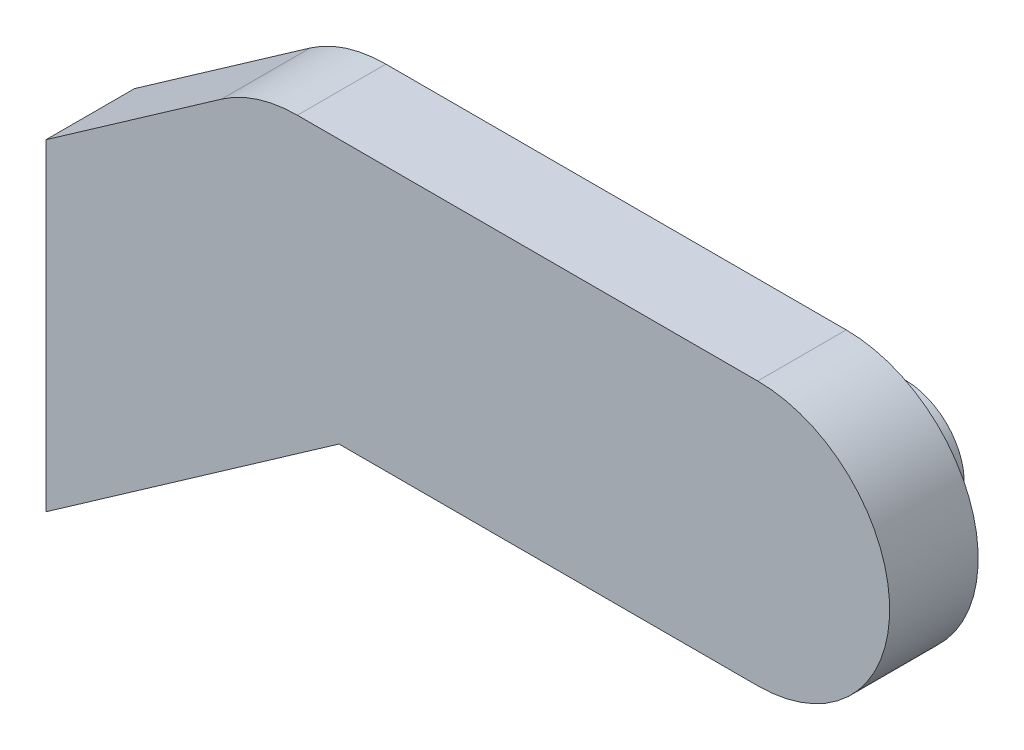
from build123d import *

# Parameters (mm, degrees)
SKETCH_1_W          = 300
SKETCH_1_H          = 44.73
EXTRUDE_1_DEPTH     = 15
CUT_EXTRUDE_4_REACH = 305.687
SKETCH_6_R          = 10
EXTRUDE_2_DEPTH     = 10
SKETCH_7_R          = 1
CUT_EXTRUDE_6_DEPTH = 5
EXTRUDE_START       = 15
EXTRUDE_5_DEPTH     = 15
CUT_EXTRUDE_7_DEPTH = 15


with BuildPart() as part:
    # 草图1 → 凸台-拉伸1 (new body)
    with BuildSketch(Plane.XY):
        with Locations((150, 22.365)):
            Rectangle(SKETCH_1_W, SKETCH_1_H)
    extrude(amount=EXTRUDE_1_DEPTH)

    # 草图4 → 切除-拉伸4 (cut, up to next)
    with BuildSketch(Plane.XY.offset(15), mode=Mode.PRIVATE) as cut_extrude_4_sk1:
        with BuildLine():
            Line((300, 44.73), (153.211623388, 44.73))
            ThreePointArc((153.211623388, 44.73), (175.576623388, 22.365), (153.211623388, 0))
            Line((153.211623388, 0), (300, 0))
            Line((300, 0), (300, 44.73))
        make_face()
    cut_extrude_4_tool1 = extrude(cut_extrude_4_sk1.sketch, amount=-CUT_EXTRUDE_4_REACH, mode=Mode.PRIVATE) & part.part
    add(cut_extrude_4_tool1.solids().sort_by_distance((235.292113, 22.365, 15))[0], mode=Mode.SUBTRACT)

    # 草图6 → 凸台-拉伸2 (add)
    with BuildSketch(Plane(origin=(0, 0, 0), x_dir=(-1, 0, 0), z_dir=(0, 0, -1))):
        with Locations((-153.211623388, 22.365)):
            Circle(SKETCH_6_R)
    extrude(amount=EXTRUDE_2_DEPTH)

    # 草图7 → 切除-拉伸6 (cut)
    with BuildSketch(Plane(origin=(0, 0, -10), x_dir=(-1, 0, 0), z_dir=(0, 0, -1))):
        with Locations((-153.211623388, 29.365)):
            Circle(SKETCH_7_R)
        with Locations((-146.211623388, 22.365)):
            Circle(SKETCH_7_R)
        with Locations((-153.211623388, 15.365)):
            Circle(SKETCH_7_R)
        with Locations((-160.211623388, 22.365)):
            Circle(SKETCH_7_R)
    extrude(amount=-CUT_EXTRUDE_6_DEPTH, mode=Mode.SUBTRACT)

    # 草图9 → 凸台-拉伸5 (add)
    # profile 1 of 8: a face of its own
    with BuildSketch(Plane.XY.offset(EXTRUDE_START)):
        with BuildLine():
            ThreePointArc((56.891287917, 9.536963001), (53.186397992, 26.248641494), (62.383586389, 40.685335471))
            Line((62.383586389, 40.685335471), (32.615717085, 19.841648987))
            Line((32.615717085, 19.841648987), (32.615717085, -7.46097469))
            Line((32.615717085, -7.46097469), (56.891287917, 9.536963001))
        make_face()
    # profile 2 of 8: a face of its own
    with BuildSketch(Plane.XY.offset(EXTRUDE_START)):
        with BuildLine():
            ThreePointArc((75.211623388, 0), (64.884615653, 2.527002716), (56.891287917, 9.536963001))
            Line((56.891287917, 9.536963001), (32.615717085, -7.46097469))
            Line((32.615717085, -7.46097469), (32.615717085, -34.763598368))
            Line((32.615717085, -34.763598368), (82.263280801, 0))
            Line((82.263280801, 0), (75.211623388, 0))
        make_face()
    # profile 3 of 8: a face of its own
    with BuildSketch(Plane.XY.offset(EXTRUDE_START)):
        with BuildLine():
            ThreePointArc((97.576623388, 22.365), (91.026066549, 38.179443161), (75.211623388, 44.73))
            ThreePointArc((75.211623388, 44.73), (68.486338182, 43.694879603), (62.383586389, 40.685335471))
            ThreePointArc((62.383586389, 40.685335471), (53.186397992, 26.248641494), (56.891287917, 9.536963001))
            Line((56.891287917, 9.536963001), (75.211623388, 22.365))
            Line((75.211623388, 22.365), (97.576623388, 22.365))
        make_face()
    # profile 4 of 8: a face of its own
    with BuildSketch(Plane.XY.offset(EXTRUDE_START)):
        with BuildLine():
            ThreePointArc((88.039660387, 4.044664529), (95.049620672, 12.037992265), (97.576623388, 22.365))
            Line((97.576623388, 22.365), (75.211623388, 22.365))
            Line((75.211623388, 22.365), (56.891287917, 9.536963001))
            ThreePointArc((56.891287917, 9.536963001), (64.884615653, 2.527002716), (75.211623388, 0))
            ThreePointArc((75.211623388, 0), (81.936908594, 1.035120397), (88.039660387, 4.044664529))
        make_face()
    # profile 5 of 8: a face of its own
    with BuildSketch(Plane.XY.offset(EXTRUDE_START)):
        with BuildLine():
            ThreePointArc((153.211623388, 0), (137.397180227, 6.550556839), (130.846623388, 22.365))
            Line((130.846623388, 22.365), (97.576623388, 22.365))
            ThreePointArc((97.576623388, 22.365), (95.049620672, 12.037992265), (88.039660387, 4.044664529))
            Line((88.039660387, 4.044664529), (82.263280801, 0))
            Line((82.263280801, 0), (153.211623388, 0))
        make_face()
    # profile 6 of 8: a face of its own
    with BuildSketch(Plane.XY.offset(EXTRUDE_START)):
        with BuildLine():
            ThreePointArc((130.846623388, 22.365), (137.397180227, 38.179443161), (153.211623388, 44.73))
            Line((153.211623388, 44.73), (75.211623388, 44.73))
            ThreePointArc((75.211623388, 44.73), (91.026066549, 38.179443161), (97.576623388, 22.365))
            Line((97.576623388, 22.365), (130.846623388, 22.365))
        make_face()
    # profile 7 of 8: a face of its own
    with BuildSketch(Plane.XY.offset(EXTRUDE_START)):
        with BuildLine():
            ThreePointArc((175.576623388, 22.365), (169.026066549, 38.179443161), (153.211623388, 44.73))
            ThreePointArc((153.211623388, 44.73), (137.397180227, 38.179443161), (130.846623388, 22.365))
            ThreePointArc((130.846623388, 22.365), (137.397180227, 6.550556839), (153.211623388, 0))
            ThreePointArc((153.211623388, 0), (169.026066549, 6.550556839), (175.576623388, 22.365))
        make_face()
        with BuildLine():
            ThreePointArc((163.211623388, 22.365), (153.211623388, 12.365), (143.211623388, 22.365))
            ThreePointArc((143.211623388, 22.365), (153.211623388, 32.365), (163.211623388, 22.365))
        make_face(mode=Mode.SUBTRACT)
    # profile 8 of 8: a face of its own
    with BuildSketch(Plane.XY.offset(EXTRUDE_START)):
        with BuildLine():
            Line((82.263280801, 0), (88.039660387, 4.044664529))
            ThreePointArc((88.039660387, 4.044664529), (81.936908594, 1.035120397), (75.211623388, 0))
            Line((75.211623388, 0), (82.263280801, 0))
        make_face()
    extrude(amount=-EXTRUDE_5_DEPTH)

    # 草图10 → 切除-拉伸7 (cut)
    with BuildSketch(Plane(origin=(0, 0, 0), x_dir=(-1, 0, 0), z_dir=(0, 0, -1))):
        with BuildLine():
            Line((-32.615717085, 19.841648987), (-32.615717085, 0))
            Line((-32.615717085, 0), (0, 0))
            Line((0, 0), (0, 44.73))
            Line((0, 44.73), (-75.211623388, 44.73))
            ThreePointArc((-75.211623388, 44.73), (-68.486338182, 43.694879603), (-62.383586389, 40.685335471))
            Line((-62.383586389, 40.685335471), (-32.615717085, 19.841648987))
        make_face()
    extrude(amount=-CUT_EXTRUDE_7_DEPTH, mode=Mode.SUBTRACT)


solid = part.part
